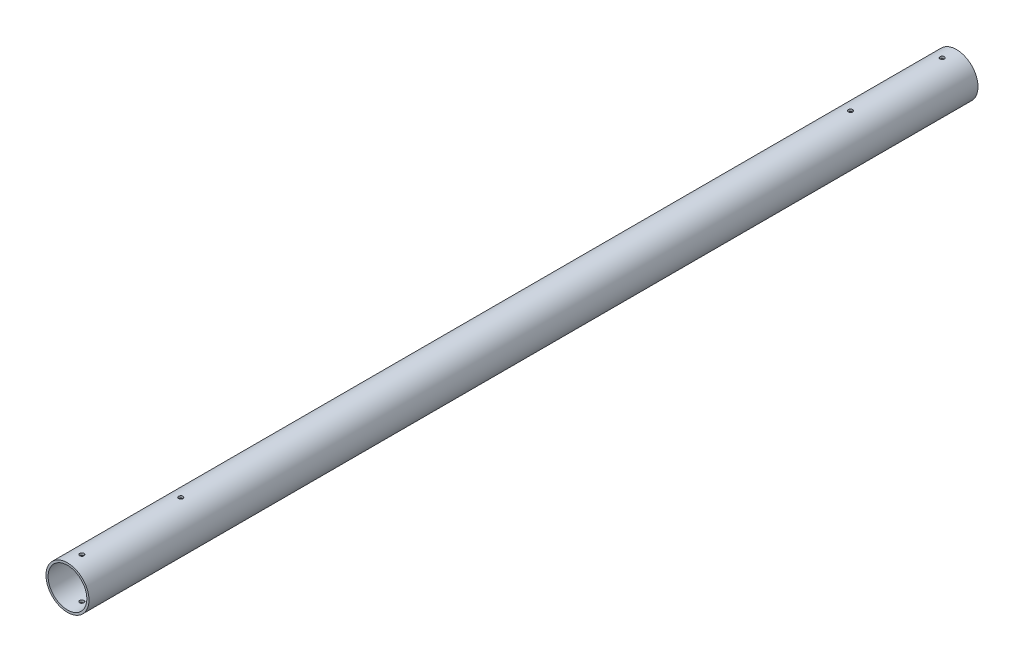
from build123d import *

# Parameters (mm, degrees)
SKETCH1_R               = 15
BOSS_EXTRUDE1_DEPTH     = 620
SKETCH2_R               = 13.5
CUT_EXTRUDE1_DEPTH      = 621.362797079
CUT_EXTRUDE2_DEPTH      = 621.362797079
CUT_EXTRUDE2_DEPTH_BACK = 621.362797079
SKETCH3_R               = 1.5


with BuildPart() as part:
    # Sketch1 → Boss-Extrude1 (new body)
    with BuildSketch(Plane.XY):
        Circle(SKETCH1_R)
    extrude(amount=BOSS_EXTRUDE1_DEPTH)

    # Sketch2 → Cut-Extrude1 (cut, through all)
    with BuildSketch(Plane(origin=(0, 0, 0), x_dir=(-1, 0, 0), z_dir=(0, 0, -1))):
        Circle(SKETCH2_R)
    extrude(amount=-CUT_EXTRUDE1_DEPTH, mode=Mode.SUBTRACT)

    # Sketch3 → Cut-Extrude2 (cut, two sides: drawn at the far end of the back side and taken through both)
    with BuildSketch(Plane(origin=(0, 0, 0), x_dir=(1, 0, 0), z_dir=(0, 1, 0)).offset(-CUT_EXTRUDE2_DEPTH_BACK)):
        with Locations(Location((0, -10, 0), (0, 0, 270))):
            Circle(SKETCH3_R)
        with Locations(Location((0, -610, 0), (0, 0, 270))):
            Circle(SKETCH3_R)
        with Locations(Location((0, -74, 0), (0, 0, 270))):
            Circle(SKETCH3_R)
        with Locations(Location((0, -541, 0), (0, 0, 270))):
            Circle(SKETCH3_R)
    extrude(amount=CUT_EXTRUDE2_DEPTH + CUT_EXTRUDE2_DEPTH_BACK, mode=Mode.SUBTRACT)


solid = part.part
